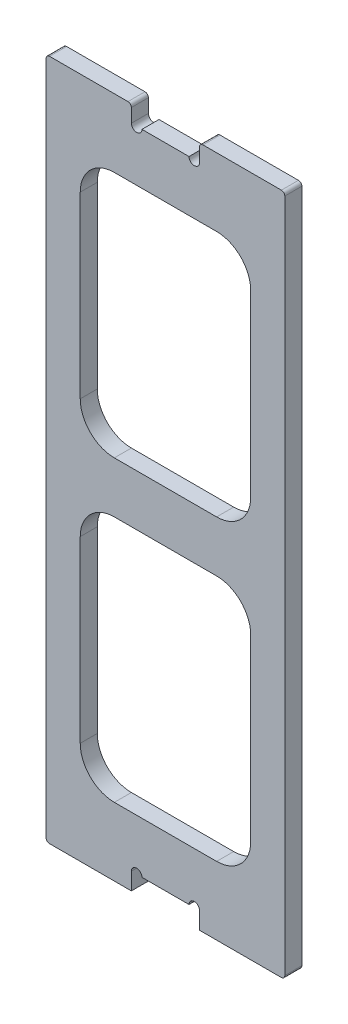
from build123d import *

# Parameters (mm, degrees)
SKETCH_1_W          = 25
SKETCH_1_H          = 5
SKETCH_1_W_2        = 70
SKETCH_1_H_2        = 190
EXTRUDE_1_DEPTH     = 5
SKETCH_2_R          = 1.55
CUT_EXTRUDE_1_DEPTH = 5
SKETCH_3_W          = 50
SKETCH_3_H          = 72.5
CUT_EXTRUDE_2_DEPTH = 5
FILLET_1_R          = 10
FILLET_2_R          = 1


with BuildPart() as part:
    # 草图1 → 凸台-拉伸1 (new body)
    with BuildSketch(Plane.XY):
        with Locations((57.5, 192.5)):
            Rectangle(SKETCH_1_W, SKETCH_1_H)
        with Locations((35, 95)):
            Rectangle(SKETCH_1_W_2, SKETCH_1_H_2)
        with Locations((12.5, 192.5)):
            Rectangle(SKETCH_1_W, SKETCH_1_H)
        with Locations((57.5, -2.5)):
            Rectangle(SKETCH_1_W, SKETCH_1_H)
        with Locations((12.5, -2.5)):
            Rectangle(SKETCH_1_W, SKETCH_1_H)
    extrude(amount=EXTRUDE_1_DEPTH)

    # 草图2 → 切除-拉伸1 (cut)
    with BuildSketch(Plane.XY.offset(5)):
        with Locations((43.45, 0)):
            Circle(SKETCH_2_R)
        with Locations((26.55, 0)):
            Circle(SKETCH_2_R)
        with Locations((43.45, 190)):
            Circle(SKETCH_2_R)
        with Locations((26.55, 190)):
            Circle(SKETCH_2_R)
    extrude(amount=-CUT_EXTRUDE_1_DEPTH, mode=Mode.SUBTRACT)

    # 草图3 → 切除-拉伸2 (cut)
    with BuildSketch(Plane.XY.offset(5)):
        with Locations((35, 51.25)):
            Rectangle(SKETCH_3_W, SKETCH_3_H)
        with Locations((35, 138.75)):
            Rectangle(SKETCH_3_W, SKETCH_3_H)
    extrude(amount=-CUT_EXTRUDE_2_DEPTH, mode=Mode.SUBTRACT)

    # 圆角1
    fillet_1_edges = [part.edges().sort_by_distance(p)[0] for p in [
        (10, 175, 2.5),
        (60, 175, 2.5),
        (60, 102.5, 2.5),
        (10, 15, 2.5),
        (10, 87.5, 2.5),
        (60, 87.5, 2.5),
        (60, 15, 2.5),
        (10, 102.5, 2.5),
    ]]
    fillet(fillet_1_edges, radius=FILLET_1_R)

    # 圆角2
    fillet_2_edges = [part.edges().sort_by_distance(p)[0] for p in [
        (45, 195, 2.5),
        (70, 195, 2.5),
        (70, -5, 2.5),
        (0, -5, 2.5),
        (0, 195, 2.5),
        (25, 195, 2.5),
    ]]
    fillet(fillet_2_edges, radius=FILLET_2_R)


solid = part.part
